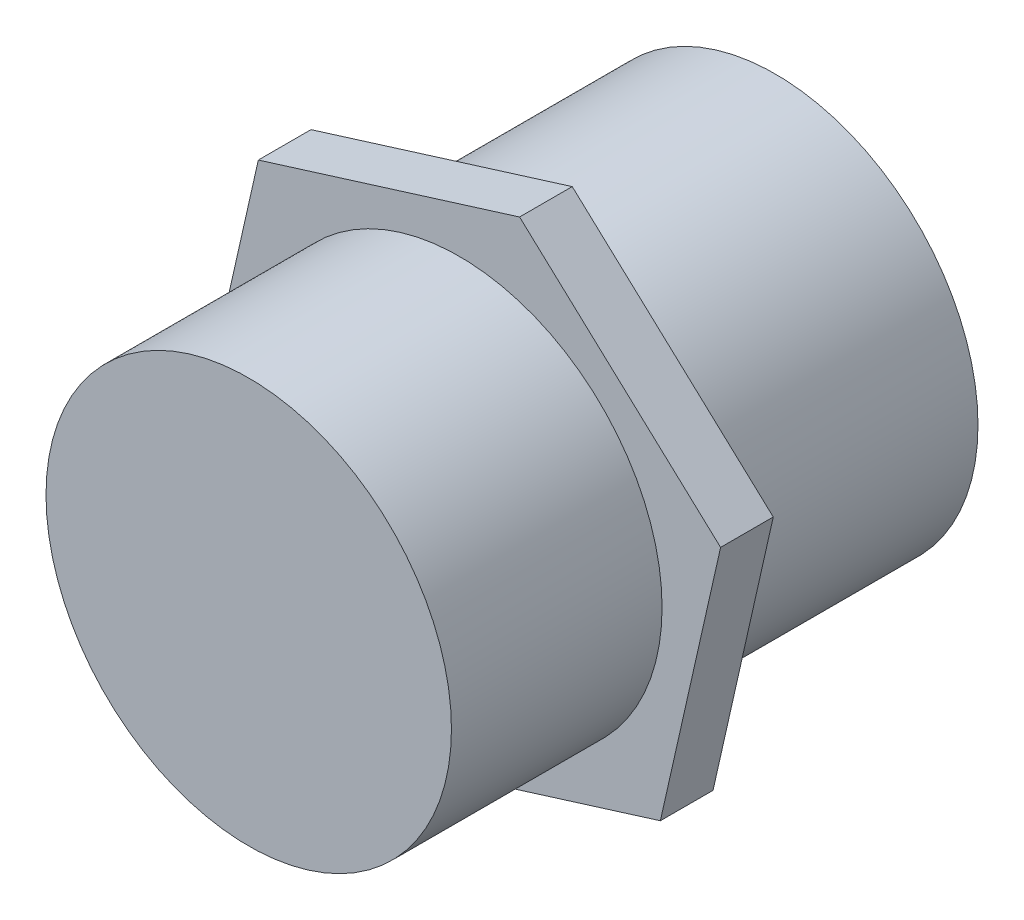
from build123d import *

# Parameters (mm, degrees)
BOSS_EXTRUDE1_DEPTH      = 10
BOSS_EXTRUDE1_DEPTH_BACK = 10
SKETCH1_R                = 7.7
SKETCH1_3_R              = 7.7
BOSS_EXTRUDE2_DEPTH      = 2


with BuildPart() as part:
    # Sketch1 → Boss-Extrude1 (new, two sides: drawn at the far end of the back side and taken through both)
    with BuildSketch(Plane.XY.offset(-BOSS_EXTRUDE1_DEPTH_BACK)):
        Circle(SKETCH1_R)
    extrude(amount=BOSS_EXTRUDE1_DEPTH + BOSS_EXTRUDE1_DEPTH_BACK)


with BuildPart() as body_2:
    # Sketch1<3> → Boss-Extrude2 (new body)
    with BuildSketch(Plane.XY):
        Polygon((-2.287768192, -10.137362413), (7.635329281, -7.049946579), (9.923097473, 3.087415834), (2.287768192, 10.137362413), (-7.635329281, 7.049946579), (-9.923097473, -3.087415834), align=None)
        Circle(SKETCH1_3_R, mode=Mode.SUBTRACT)
    extrude(amount=BOSS_EXTRUDE2_DEPTH)


solid = Compound([part.part, body_2.part])
